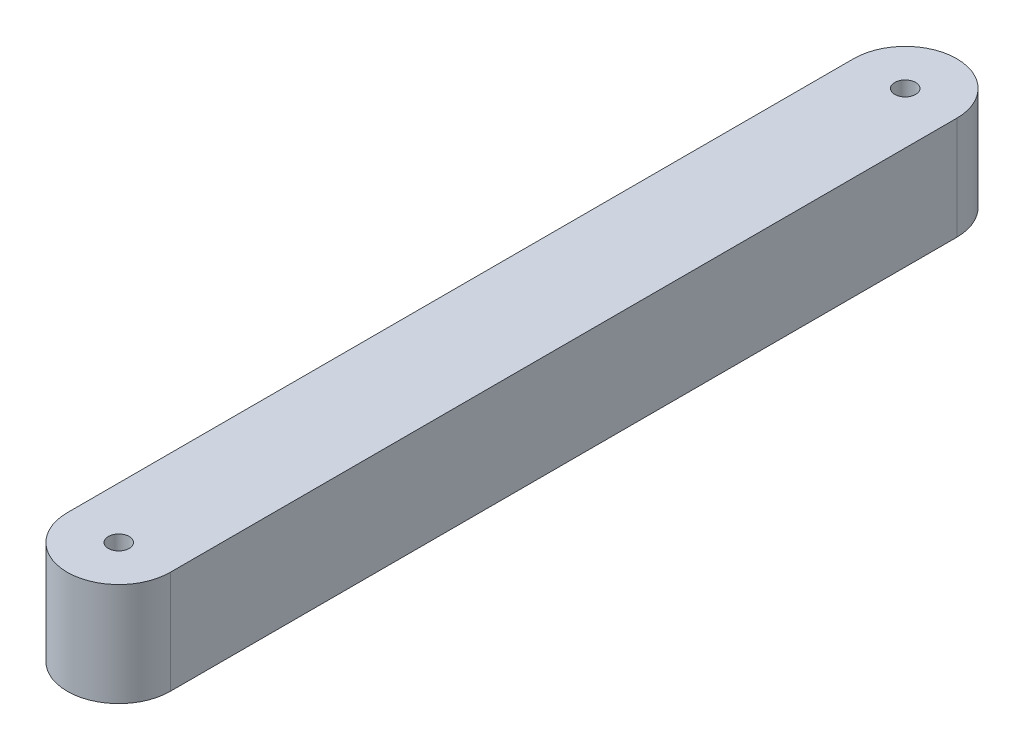
from build123d import *

# Parameters (mm, degrees)
SKETCH1_R           = 2.022448349
BOSS_EXTRUDE1_DEPTH = 20


with BuildPart() as part:
    # Sketch1 → Boss-Extrude1 (new body)
    with BuildSketch(Plane(origin=(0, 0, 0), x_dir=(1, 0, 0), z_dir=(0, 1, 0))):
        with BuildLine():
            Line((-10, 0), (-10, 152.5))
            ThreePointArc((-10, 152.5), (0, 162.5), (10, 152.5))
            Line((10, 152.5), (10, 0))
            ThreePointArc((10, 0), (0, -10), (-10, 0))
        make_face()
        with Locations(Location((0, 0, 0), (0, 0, 270))):
            Circle(SKETCH1_R, mode=Mode.SUBTRACT)
        with Locations(Location((0, 152.5, 0), (0, 0, 270))):
            Circle(SKETCH1_R, mode=Mode.SUBTRACT)
    extrude(amount=BOSS_EXTRUDE1_DEPTH)


solid = part.part
